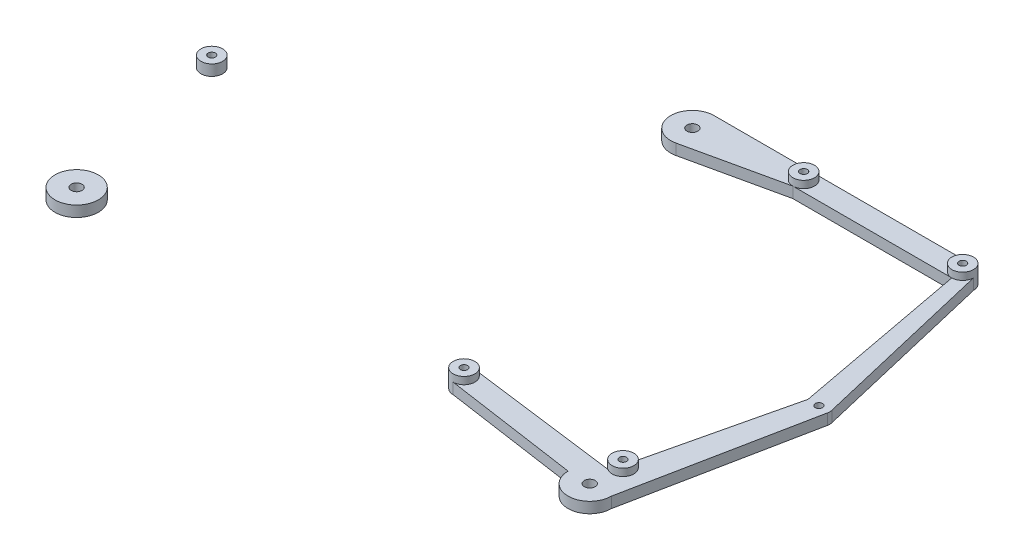
from build123d import *
from build123d.topology import SkipClean

# Parameters (mm, degrees)
SKETCH1_R                         = 6
SKETCH1_R_2                       = 1.5
AUDIOHOLDER_LINKS_DEPTH           = 3
AUDIOHOLDER_LINKS_2_DEPTH         = 3
AUDIOHOLDER_LINKS_3_DEPTH         = 3
SKETCH1_R_3                       = 3
SKETCH1_R_4                       = 1
AUDIOHOLDER_LINKS_4_DEPTH         = 3
AUDIOHOLDER_LINKS_5_DEPTH         = 3
SKETCH3_R                         = 3
SKETCH3_R_2                       = 1
MODEM_STANDOFFS_DEPTH             = 2
MODEM_STANDOFFS_DIRECTION_2_REACH = 156.501
SKETCH4_R                         = 1
SKETCH4_R_2                       = 1.5
SCREWHOLE_LINKS_1_DEPTH           = 3


with BuildPart() as part:
    # Sketch1 → AudioHolder links (new body)
    with BuildSketch(Plane(origin=(0, 53.5, 0), x_dir=(1, 0, 0), z_dir=(0, 1, 0))):
        with Locations(Location((-36, -88.75, 0), (0, 0, 270))):
            Circle(SKETCH1_R)
        with Locations(Location((-36, -88.75, 0), (0, 0, 270))):
            Circle(SKETCH1_R_2, mode=Mode.SUBTRACT)
    extrude(amount=AUDIOHOLDER_LINKS_DEPTH)


with BuildPart() as body_2:
    # Sketch1 → AudioHolder links 2 (new body)
    with BuildSketch(Plane(origin=(0, 53.5, 0), x_dir=(1, 0, 0), z_dir=(0, 1, 0))):
        with Locations(Location((35, 10.65, 0), (0, 0, 270))):
            Circle(SKETCH1_R)
        with Locations(Location((35, 10.65, 0), (0, 0, 270))):
            Circle(SKETCH1_R_2, mode=Mode.SUBTRACT)
    extrude(amount=AUDIOHOLDER_LINKS_2_DEPTH)



with BuildPart() as body_3:
    # Sketch1 → AudioHolder links 3 (new body)
    with BuildSketch(Plane(origin=(0, 53.5, 0), x_dir=(1, 0, 0), z_dir=(0, 1, 0))):
        with Locations(Location((106, -88.75, 0), (0, 0, 270))):
            Circle(SKETCH1_R)
        with Locations(Location((106, -88.75, 0), (0, 0, 270))):
            Circle(SKETCH1_R_2, mode=Mode.SUBTRACT)
    extrude(amount=AUDIOHOLDER_LINKS_3_DEPTH)

    # Sketch3 → Modem standoffs (add)
    # profile 1 of 4: a face of its own
    with BuildSketch(Plane(origin=(0, 56.5, 0), x_dir=(1, 0, 0), z_dir=(0, 1, 0))):
        with Locations(Location((106.8, 13.65, 0), (0, 0, 270))):
            Circle(SKETCH3_R)
        with Locations(Location((106.8, 13.65, 0), (0, 0, 270))):
            Circle(SKETCH3_R_2, mode=Mode.SUBTRACT)
    # profile 2 of 4: a face of its own
    with BuildSketch(Plane(origin=(0, 56.5, 0), x_dir=(1, 0, 0), z_dir=(0, 1, 0))):
        with Locations(Location((62.8, 13.65, 0), (0, 0, 270))):
            Circle(SKETCH3_R)
        with Locations(Location((62.8, 13.65, 0), (0, 0, 270))):
            Circle(SKETCH3_R_2, mode=Mode.SUBTRACT)
    # profile 3 of 4: a face of its own
    with BuildSketch(Plane(origin=(0, 56.5, 0), x_dir=(1, 0, 0), z_dir=(0, 1, 0))):
        with Locations(Location((62.8, -80.35, 0), (0, 0, 270))):
            Circle(SKETCH3_R)
        with Locations(Location((62.8, -80.35, 0), (0, 0, 270))):
            Circle(SKETCH3_R_2, mode=Mode.SUBTRACT)
    # profile 4 of 4: a face of its own
    with BuildSketch(Plane(origin=(0, 56.5, 0), x_dir=(1, 0, 0), z_dir=(0, 1, 0))):
        with Locations(Location((106.8, -80.35, 0), (0, 0, 270))):
            Circle(SKETCH3_R)
        with Locations(Location((106.8, -80.35, 0), (0, 0, 270))):
            Circle(SKETCH3_R_2, mode=Mode.SUBTRACT)
    extrude(amount=MODEM_STANDOFFS_DEPTH)

    # Modem standoffs direction 2: up to this face of the body (flat: up to its plane)
    modem_standoffs_direction_2_end = Plane(body_3.part.faces().sort_by_distance((106, 53.5, 82.919705627))[0])
    # Sketch3 → Modem standoffs direction 2 (add, up to the picked face)
    with BuildSketch(Plane(origin=(0, 56.5, 0), x_dir=(1, 0, 0), z_dir=(0, 1, 0)), mode=Mode.PRIVATE) as modem_standoffs_direction_2_sk1:
        with Locations(Location((106.8, 13.65, 0), (0, 0, 270))):
            Circle(SKETCH3_R)
        with Locations(Location((106.8, 13.65, 0), (0, 0, 270))):
            Circle(SKETCH3_R_2, mode=Mode.SUBTRACT)
    modem_standoffs_direction_2_tool1 = split(extrude(modem_standoffs_direction_2_sk1.sketch, amount=-MODEM_STANDOFFS_DIRECTION_2_REACH, mode=Mode.PRIVATE), bisect_by=modem_standoffs_direction_2_end, keep=Keep.BOTH, mode=Mode.PRIVATE)
    # Sketch3 → Modem standoffs direction 2 (add, up to the picked face)
    with BuildSketch(Plane(origin=(0, 56.5, 0), x_dir=(1, 0, 0), z_dir=(0, 1, 0)), mode=Mode.PRIVATE) as modem_standoffs_direction_2_sk2:
        with Locations(Location((62.8, 13.65, 0), (0, 0, 270))):
            Circle(SKETCH3_R)
        with Locations(Location((62.8, 13.65, 0), (0, 0, 270))):
            Circle(SKETCH3_R_2, mode=Mode.SUBTRACT)
    modem_standoffs_direction_2_tool2 = split(extrude(modem_standoffs_direction_2_sk2.sketch, amount=-MODEM_STANDOFFS_DIRECTION_2_REACH, mode=Mode.PRIVATE), bisect_by=modem_standoffs_direction_2_end, keep=Keep.BOTH, mode=Mode.PRIVATE)
    # Sketch3 → Modem standoffs direction 2 (add, up to the picked face)
    with BuildSketch(Plane(origin=(0, 56.5, 0), x_dir=(1, 0, 0), z_dir=(0, 1, 0)), mode=Mode.PRIVATE) as modem_standoffs_direction_2_sk3:
        with Locations(Location((62.8, -80.35, 0), (0, 0, 270))):
            Circle(SKETCH3_R)
        with Locations(Location((62.8, -80.35, 0), (0, 0, 270))):
            Circle(SKETCH3_R_2, mode=Mode.SUBTRACT)
    modem_standoffs_direction_2_tool3 = split(extrude(modem_standoffs_direction_2_sk3.sketch, amount=-MODEM_STANDOFFS_DIRECTION_2_REACH, mode=Mode.PRIVATE), bisect_by=modem_standoffs_direction_2_end, keep=Keep.BOTH, mode=Mode.PRIVATE)
    # Sketch3 → Modem standoffs direction 2 (add, up to the picked face)
    with BuildSketch(Plane(origin=(0, 56.5, 0), x_dir=(1, 0, 0), z_dir=(0, 1, 0)), mode=Mode.PRIVATE) as modem_standoffs_direction_2_sk4:
        with Locations(Location((106.8, -80.35, 0), (0, 0, 270))):
            Circle(SKETCH3_R)
        with Locations(Location((106.8, -80.35, 0), (0, 0, 270))):
            Circle(SKETCH3_R_2, mode=Mode.SUBTRACT)
    modem_standoffs_direction_2_tool4 = split(extrude(modem_standoffs_direction_2_sk4.sketch, amount=-MODEM_STANDOFFS_DIRECTION_2_REACH, mode=Mode.PRIVATE), bisect_by=modem_standoffs_direction_2_end, keep=Keep.BOTH, mode=Mode.PRIVATE)
    add(modem_standoffs_direction_2_tool1.solids().sort_by(Axis((106.8, 56.5, -16.565147), (0, -1, 0)))[0])
    add(modem_standoffs_direction_2_tool2.solids().sort_by(Axis((62.8, 56.5, -16.565147), (0, -1, 0)))[0])
    add(modem_standoffs_direction_2_tool3.solids().sort_by(Axis((62.8, 56.5, 77.434853), (0, -1, 0)))[0])
    add(modem_standoffs_direction_2_tool4.solids().sort_by(Axis((106.8, 56.5, 77.434853), (0, -1, 0)))[0])


with BuildPart() as body_4:
    # Sketch1 → AudioHolder links 4 (new body)
    with BuildSketch(Plane(origin=(0, 53.5, 0), x_dir=(1, 0, 0), z_dir=(0, 1, 0))):
        with Locations(Location((119, -38.35, 0), (0, 0, 270))):
            Circle(SKETCH1_R_3)
        with Locations(Location((119, -38.35, 0), (0, 0, 270))):
            Circle(SKETCH1_R_4, mode=Mode.SUBTRACT)
    extrude(amount=AUDIOHOLDER_LINKS_4_DEPTH)


with BuildPart() as body_5:
    # Sketch1 → AudioHolder links 5 (new body)
    with BuildSketch(Plane(origin=(0, 53.5, 0), x_dir=(1, 0, 0), z_dir=(0, 1, 0))):
        with Locations(Location((-49, -38.35, 0), (0, 0, 270))):
            Circle(SKETCH1_R_3)
        with Locations(Location((-49, -38.35, 0), (0, 0, 270))):
            Circle(SKETCH1_R_4, mode=Mode.SUBTRACT)
    extrude(amount=AUDIOHOLDER_LINKS_5_DEPTH)


with BuildPart() as modem_standoffs_piece_1:
    # of the separate pieces the step leaves, piece 1, a body of its own (modem_standoffs_pieces)
    add(body_3.part.solids().sort_by_distance((108.008074852, 56.5, 83.096007129))[0])


with BuildPart() as modem_standoffs_piece_2:
    # of the separate pieces the step leaves, piece 2, a body of its own (modem_standoffs_pieces)
    add(body_3.part.solids().sort_by_distance((62.8, 58.5, 83.35))[0])


with BuildPart() as modem_standoffs_piece_3:
    # of the separate pieces the step leaves, piece 3, a body of its own (modem_standoffs_pieces)
    add(body_3.part.solids().sort_by_distance((106.8, 58.5, -10.65))[0])


with BuildPart() as modem_standoffs_piece_4:
    # of the separate pieces the step leaves, piece 4, a body of its own (modem_standoffs_pieces)
    add(body_3.part.solids().sort_by_distance((62.8, 58.5, -10.65))[0])


with BuildPart() as body_2_1:
    with SkipClean():  # the faces are left unmerged after this step: merging them gives an invalid solid
        add(body_2.part)

        add(body_4.part)  # Screwhole links 1 merges body 4

        add(modem_standoffs_piece_1.part)  # Screwhole links 1 merges Modem standoffs piece 1

        add(modem_standoffs_piece_2.part)  # Screwhole links 1 merges Modem standoffs piece 2

        add(modem_standoffs_piece_3.part)  # Screwhole links 1 merges Modem standoffs piece 3

        add(modem_standoffs_piece_4.part)  # Screwhole links 1 merges Modem standoffs piece 4
        # Sketch4 → Screwhole links 1 (add)
        with BuildSketch(Plane.XZ.offset(-53.5)):
            with BuildLine():
                Line((109.8, -13.65), (121.919658846, 37.66036805))
                ThreePointArc((121.919658846, 37.66036805), (121.999541856, 38.297572397), (121.941975635, 38.937179156))
                Line((121.941975635, 38.937179156), (112, 88.75))
                ThreePointArc((112, 88.75), (106, 94.75), (100, 88.75))
                Line((100, 88.75), (62.8, 83.35))
                ThreePointArc((62.8, 83.35), (59.806254499, 80.156382136), (63.186428406, 77.374991918))
                Line((63.186428406, 77.374991918), (105.095295934, 82.818599613))
                ThreePointArc((105.095295934, 82.818599613), (103.935929572, 79.457195105), (106.8, 77.35))
                Line((106.8, 77.35), (116, 38.35))
                Line((116, 38.35), (106.8, -10.65))
                Line((106.8, -10.65), (62.8, -10.65))
                Line((62.8, -10.65), (36.294964029, -4.791410736))
                ThreePointArc((36.294964029, -4.791410736), (29.035457453, -9.998668895), (35, -16.65))
                Line((35, -16.65), (62.8, -16.65))
                Line((62.8, -16.65), (106.8, -16.65))
                ThreePointArc((106.8, -16.65), (108.921320344, -15.771320344), (109.8, -13.65))
            make_face()
            with Locations(Location((119, 38.35, 0), (0, 0, 270))):
                Circle(SKETCH4_R, mode=Mode.SUBTRACT)
            with Locations(Location((106.8, -13.65, 0), (0, 0, 270))):
                Circle(SKETCH4_R, mode=Mode.SUBTRACT)
            with Locations(Location((62.8, -13.65, 0), (0, 0, 270))):
                Circle(SKETCH4_R, mode=Mode.SUBTRACT)
            with Locations(Location((35, -10.65, 0), (0, 0, 90))):
                Circle(SKETCH4_R_2, mode=Mode.SUBTRACT)
            with Locations(Location((106, 88.75, 0), (0, 0, 270))):
                Circle(SKETCH4_R_2, mode=Mode.SUBTRACT)
            with Locations(Location((106.8, 80.35, 0), (0, 0, 270))):
                Circle(SKETCH4_R, mode=Mode.SUBTRACT)
            with Locations(Location((62.8, 80.35, 0), (0, 0, 270))):
                Circle(SKETCH4_R, mode=Mode.SUBTRACT)
        extrude(amount=-SCREWHOLE_LINKS_1_DEPTH)


solid = Compound([part.part, body_5.part, body_2_1.part])
